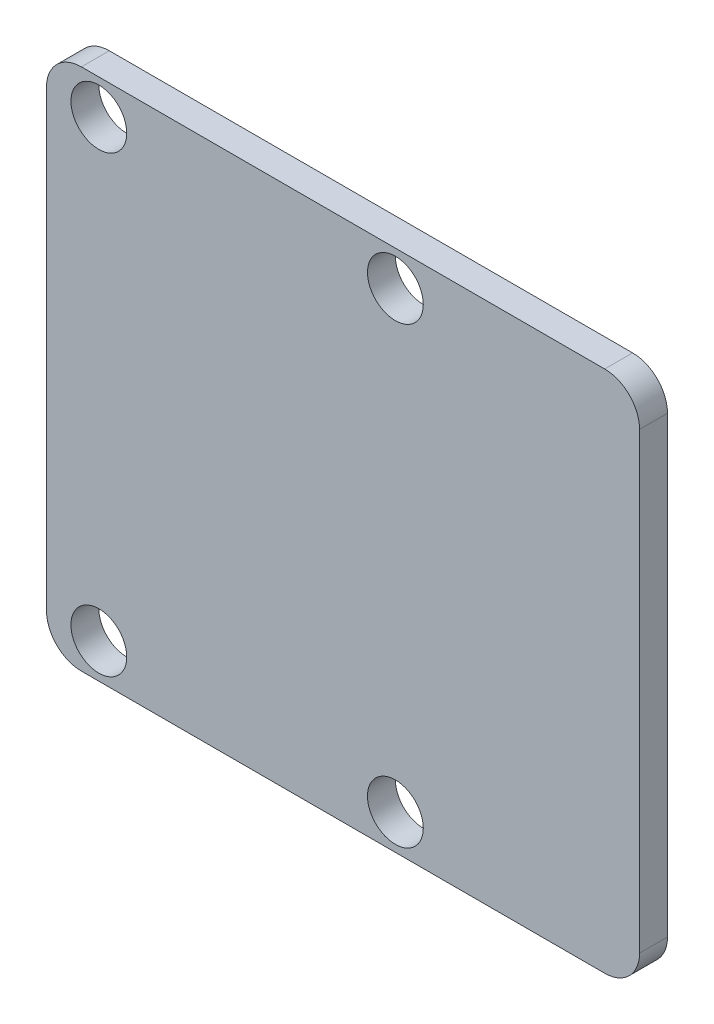
from build123d import *

# Parameters (mm, degrees)
SKETCH1_W           = 34
SKETCH1_H           = 30
BOSS_EXTRUDE1_DEPTH = 1.6
CUT_EXTRUDE1_REACH  = 24.728
SKETCH2_R           = 1.6
FILLET1_R           = 2


with BuildPart() as part:
    # Sketch1 → Boss-Extrude1 (new body)
    with BuildSketch(Plane.XY):
        Rectangle(SKETCH1_W, SKETCH1_H)
    extrude(amount=BOSS_EXTRUDE1_DEPTH)

    # Sketch2 → Cut-Extrude1 (cut, up to next)
    with BuildSketch(Plane.XY, mode=Mode.PRIVATE) as cut_extrude1_sk1:
        with Locations((-14, 13)):
            Circle(SKETCH2_R)
    cut_extrude1_tool1 = extrude(cut_extrude1_sk1.sketch, amount=CUT_EXTRUDE1_REACH, mode=Mode.PRIVATE) & part.part
    # Sketch2 → Cut-Extrude1 (cut, up to next)
    with BuildSketch(Plane.XY, mode=Mode.PRIVATE) as cut_extrude1_sk2:
        with Locations((3, 13)):
            Circle(SKETCH2_R)
    cut_extrude1_tool2 = extrude(cut_extrude1_sk2.sketch, amount=CUT_EXTRUDE1_REACH, mode=Mode.PRIVATE) & part.part
    # Sketch2 → Cut-Extrude1 (cut, up to next)
    with BuildSketch(Plane.XY, mode=Mode.PRIVATE) as cut_extrude1_sk3:
        with Locations((3, -13)):
            Circle(SKETCH2_R)
    cut_extrude1_tool3 = extrude(cut_extrude1_sk3.sketch, amount=CUT_EXTRUDE1_REACH, mode=Mode.PRIVATE) & part.part
    # Sketch2 → Cut-Extrude1 (cut, up to next)
    with BuildSketch(Plane.XY, mode=Mode.PRIVATE) as cut_extrude1_sk4:
        with Locations((-14, -13)):
            Circle(SKETCH2_R)
    cut_extrude1_tool4 = extrude(cut_extrude1_sk4.sketch, amount=CUT_EXTRUDE1_REACH, mode=Mode.PRIVATE) & part.part
    add(cut_extrude1_tool1.solids().sort_by_distance((-14, 13, 0))[0], mode=Mode.SUBTRACT)
    add(cut_extrude1_tool2.solids().sort_by_distance((3, 13, 0))[0], mode=Mode.SUBTRACT)
    add(cut_extrude1_tool3.solids().sort_by_distance((3, -13, 0))[0], mode=Mode.SUBTRACT)
    add(cut_extrude1_tool4.solids().sort_by_distance((-14, -13, 0))[0], mode=Mode.SUBTRACT)

    # Fillet1
    fillet1_edges = [part.edges().sort_by_distance(p)[0] for p in [
        (17, -15, 0.8),
        (-17, -15, 0.8),
        (-17, 15, 0.8),
        (17, 15, 0.8),
    ]]
    fillet(fillet1_edges, radius=FILLET1_R)


solid = part.part
